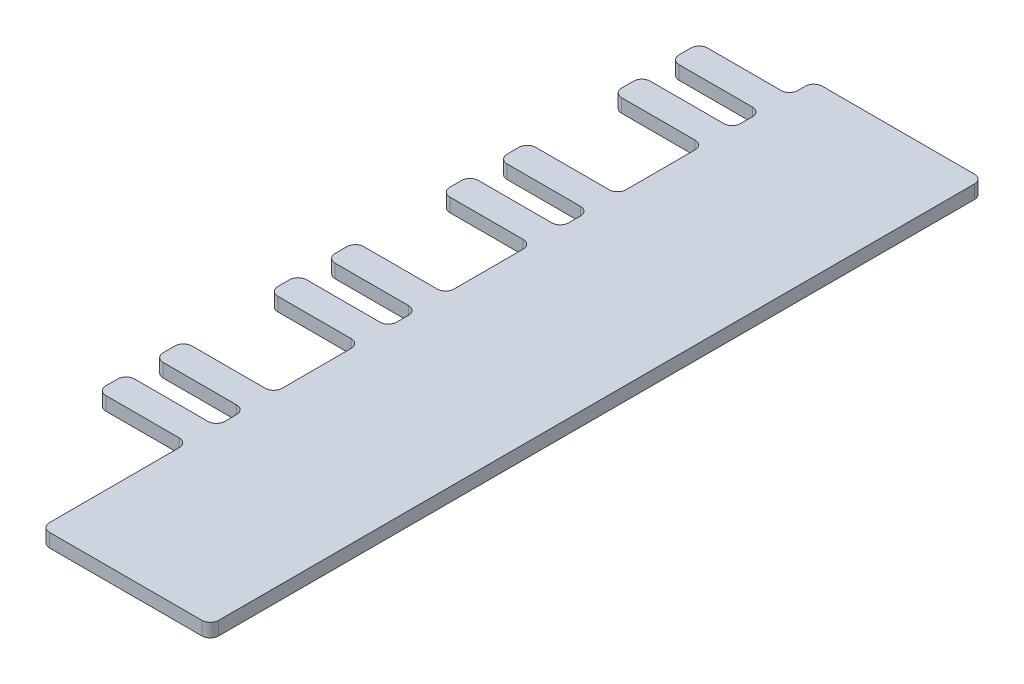
from build123d import *

# Parameters (mm, degrees)
BOSS_EXTRUDE1_DEPTH = 1.2


with BuildPart() as part:
    # Sketch1 → Boss-Extrude1 (new body)
    with BuildSketch(Plane(origin=(0, 0, 0), x_dir=(1, 0, 0), z_dir=(0, 1, 0))):
        with BuildLine():
            Line((-0.75, 13), (-7.25, 13))
            ThreePointArc((-7.25, 13), (-7.780330086, 13.219669914), (-8, 13.75))
            Line((-8, 13.75), (-8, 14.79))
            ThreePointArc((-8, 14.79), (-7.780330086, 15.320330086), (-7.25, 15.54))
            Line((-7.25, 15.54), (-0.746230206, 15.54))
            ThreePointArc((-0.746230206, 15.54), (-0.243153345, 15.733750351), (0, 16.214896874))
            Line((0, 16.214896874), (0, 17.33))
            ThreePointArc((0, 17.33), (-0.219669914, 17.860330086), (-0.75, 18.08))
            Line((-0.75, 18.08), (-7.25, 18.08))
            ThreePointArc((-7.25, 18.08), (-7.780330086, 18.299669914), (-8, 18.83))
            Line((-8, 18.83), (-8, 19.87))
            ThreePointArc((-8, 19.87), (-7.780330086, 20.400330086), (-7.25, 20.62))
            Line((-7.25, 20.62), (-0.746230206, 20.62))
            ThreePointArc((-0.746230206, 20.62), (-0.243153345, 20.813750351), (0, 21.294896874))
            Line((0, 21.294896874), (0, 27.49))
            ThreePointArc((0, 27.49), (-0.219669914, 28.020330086), (-0.75, 28.24))
            Line((-0.75, 28.24), (-7.25, 28.24))
            ThreePointArc((-7.25, 28.24), (-7.780330086, 28.459669914), (-8, 28.99))
            Line((-8, 28.99), (-8, 30.03))
            ThreePointArc((-8, 30.03), (-7.780330086, 30.560330086), (-7.25, 30.78))
            Line((-7.25, 30.78), (-0.746230206, 30.78))
            ThreePointArc((-0.746230206, 30.78), (-0.243153345, 30.973750351), (0, 31.454896874))
            Line((0, 31.454896874), (0, 32.57))
            ThreePointArc((0, 32.57), (-0.219669914, 33.100330086), (-0.75, 33.32))
            Line((-0.75, 33.32), (-7.25, 33.32))
            ThreePointArc((-7.25, 33.32), (-7.780330086, 33.539669914), (-8, 34.07))
            Line((-8, 34.07), (-8, 35.11))
            ThreePointArc((-8, 35.11), (-7.780330086, 35.640330086), (-7.25, 35.86))
            Line((-7.25, 35.86), (-0.746230206, 35.86))
            ThreePointArc((-0.746230206, 35.86), (-0.243153345, 36.053750351), (0, 36.534896874))
            Line((0, 36.534896874), (0, 42.73))
            ThreePointArc((0, 42.73), (-0.219669914, 43.260330086), (-0.75, 43.48))
            Line((-0.75, 43.48), (-7.25, 43.48))
            ThreePointArc((-7.25, 43.48), (-7.780330086, 43.699669914), (-8, 44.23))
            Line((-8, 44.23), (-8, 45.27))
            ThreePointArc((-8, 45.27), (-7.780330086, 45.800330086), (-7.25, 46.02))
            Line((-7.25, 46.02), (-0.746230206, 46.02))
            ThreePointArc((-0.746230206, 46.02), (-0.243153345, 46.213750351), (0, 46.694896874))
            Line((0, 46.694896874), (0, 47.81))
            ThreePointArc((0, 47.81), (-0.219669914, 48.340330086), (-0.75, 48.56))
            Line((-0.75, 48.56), (-7.25, 48.56))
            ThreePointArc((-7.25, 48.56), (-7.780330086, 48.779669914), (-8, 49.31))
            Line((-8, 49.31), (-8, 50.35))
            ThreePointArc((-8, 50.35), (-7.780330086, 50.880330086), (-7.25, 51.1))
            Line((-7.25, 51.1), (-0.746230206, 51.1))
            ThreePointArc((-0.746230206, 51.1), (-0.243153345, 51.293750351), (0, 51.774896874))
            Line((0, 51.774896874), (0, 57.97))
            ThreePointArc((0, 57.97), (-0.219669914, 58.500330086), (-0.75, 58.72))
            Line((-0.75, 58.72), (-7.25, 58.72))
            ThreePointArc((-7.25, 58.72), (-7.780330086, 58.939669914), (-8, 59.47))
            Line((-8, 59.47), (-8, 60.51))
            ThreePointArc((-8, 60.51), (-7.780330086, 61.040330086), (-7.25, 61.26))
            Line((-7.25, 61.26), (-0.746230206, 61.26))
            ThreePointArc((-0.746230206, 61.26), (-0.243153345, 61.453750351), (0, 61.934896874))
            Line((0, 61.934896874), (0, 63.05))
            ThreePointArc((0, 63.05), (-0.219669914, 63.580330086), (-0.75, 63.8))
            Line((-0.75, 63.8), (-7.25, 63.8))
            ThreePointArc((-7.25, 63.8), (-7.780330086, 64.019669914), (-8, 64.55))
            Line((-8, 64.55), (-8, 65.59))
            ThreePointArc((-8, 65.59), (-7.780330086, 66.120330086), (-7.25, 66.34))
            Line((-7.25, 66.34), (-0.746230206, 66.34))
            ThreePointArc((-0.746230206, 66.34), (-0.243153345, 66.533750351), (0, 67.014896874))
            Line((0, 67.014896874), (0, 67.74))
            ThreePointArc((0, 67.74), (0.219669914, 68.270330086), (0.75, 68.49))
            Line((0.75, 68.49), (14.25, 68.49))
            ThreePointArc((14.25, 68.49), (14.780330086, 68.270330086), (15, 67.74))
            Line((15, 67.74), (15, 0.75))
            ThreePointArc((15, 0.75), (14.780330086, 0.219669914), (14.25, 0))
            Line((14.25, 0), (0.75, 0))
            ThreePointArc((0.75, 0), (0.219669914, 0.219669914), (0, 0.75))
            Line((0, 0.75), (0, 12.25))
            ThreePointArc((0, 12.25), (-0.219669914, 12.780330086), (-0.75, 13))
        make_face()
    extrude(amount=BOSS_EXTRUDE1_DEPTH)


solid = part.part
